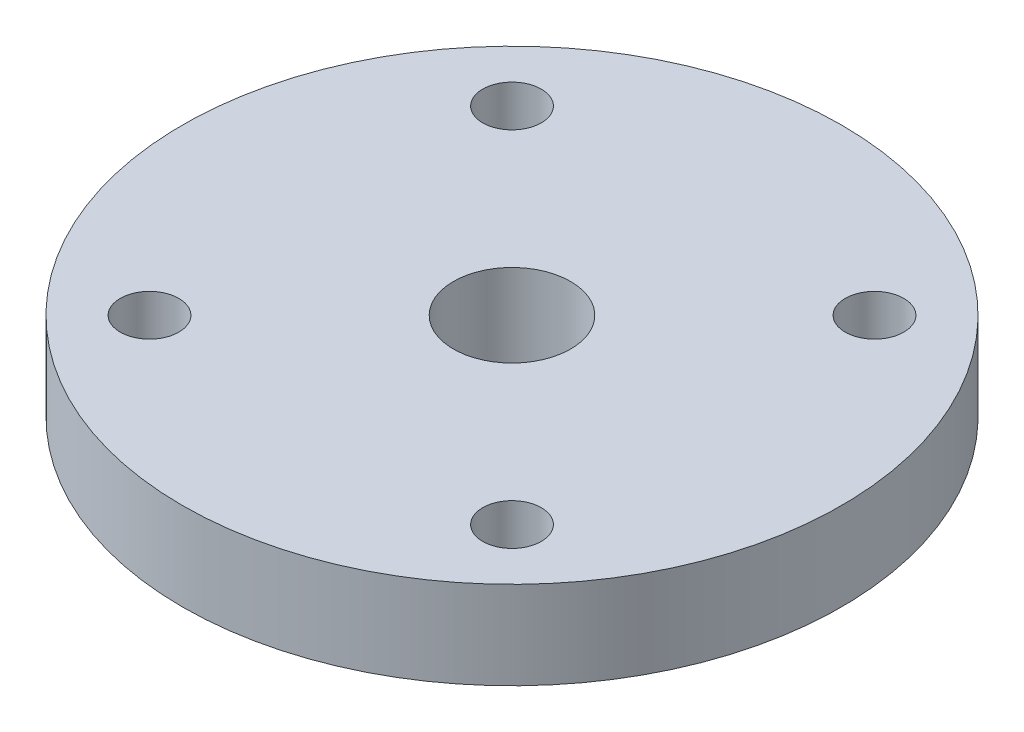
from build123d import *

# Parameters (mm, degrees)
BIT_ATTACHED_TO_SHAFT_DEPTH = 2
SKETCH2_R                   = 22.5
BOSS_EXTRUDE2_DEPTH         = 6
SKETCH3_R                   = 2
CUT_EXTRUDE1_DEPTH          = 6
SKETCH4_R                   = 4
CUT_EXTRUDE2_DEPTH          = 33.810059433


with BuildPart() as part:
    # Sketch1 → bit attached to shaft (new body)
    with BuildSketch(Plane(origin=(0, 0, 0), x_dir=(1, 0, 0), z_dir=(0, 1, 0))):
        with BuildLine():
            Line((11.5, -4.898979486), (11.5, 4.898979486))
            ThreePointArc((11.5, 4.898979486), (0, 12.5), (-11.5, 4.898979486))
            Line((-11.5, 4.898979486), (-11.5, -4.898979486))
            ThreePointArc((-11.5, -4.898979486), (0, -12.5), (11.5, -4.898979486))
        make_face()
    extrude(amount=BIT_ATTACHED_TO_SHAFT_DEPTH)

    # Sketch2 → Boss-Extrude2 (add)
    with BuildSketch(Plane(origin=(0, 2, 0), x_dir=(1, 0, 0), z_dir=(0, 1, 0))):
        with Locations(Location((0, 0, 0), (0, 0, 270))):
            Circle(SKETCH2_R)
    extrude(amount=BOSS_EXTRUDE2_DEPTH)

    # Sketch3 → Cut-Extrude1 (cut)
    with BuildSketch(Plane.XZ.offset(-2)):
        with Locations(Location((-12.374368671, -12.374368671, 0), (0, 0, 270))):
            Circle(SKETCH3_R)
        with Locations(Location((12.374368671, -12.374368671, 0), (0, 0, 270))):
            Circle(SKETCH3_R)
        with Locations(Location((12.374368671, 12.374368671, 0), (0, 0, 270))):
            Circle(SKETCH3_R)
        with Locations(Location((-12.374368671, 12.374368671, 0), (0, 0, 270))):
            Circle(SKETCH3_R)
    extrude(amount=-CUT_EXTRUDE1_DEPTH, mode=Mode.SUBTRACT)

    # Sketch4 → Cut-Extrude2 (cut, through all)
    with BuildSketch(Plane.XZ):
        with Locations(Location((0, 0, 0), (0, 0, 270))):
            Circle(SKETCH4_R)
    extrude(amount=-CUT_EXTRUDE2_DEPTH, mode=Mode.SUBTRACT)


solid = part.part
